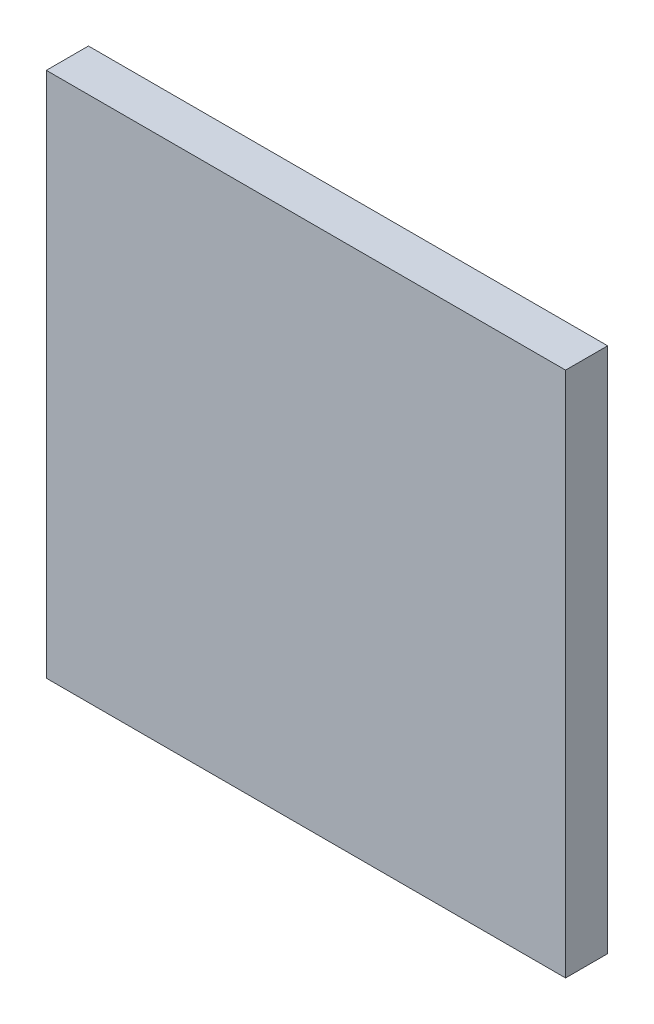
from build123d import *

# Parameters (mm, degrees)
ESBO_O1_W                = 123.29
ESBO_O1_H                = 125
RESSALTO_EXTRUS_O1_DEPTH = 10


with BuildPart() as part:
    # Esboço1 → Ressalto-extrusão1 (new body)
    with BuildSketch(Plane.XY):
        with Locations((61.645, 62.5)):
            Rectangle(ESBO_O1_W, ESBO_O1_H)
    extrude(amount=RESSALTO_EXTRUS_O1_DEPTH)


solid = part.part
